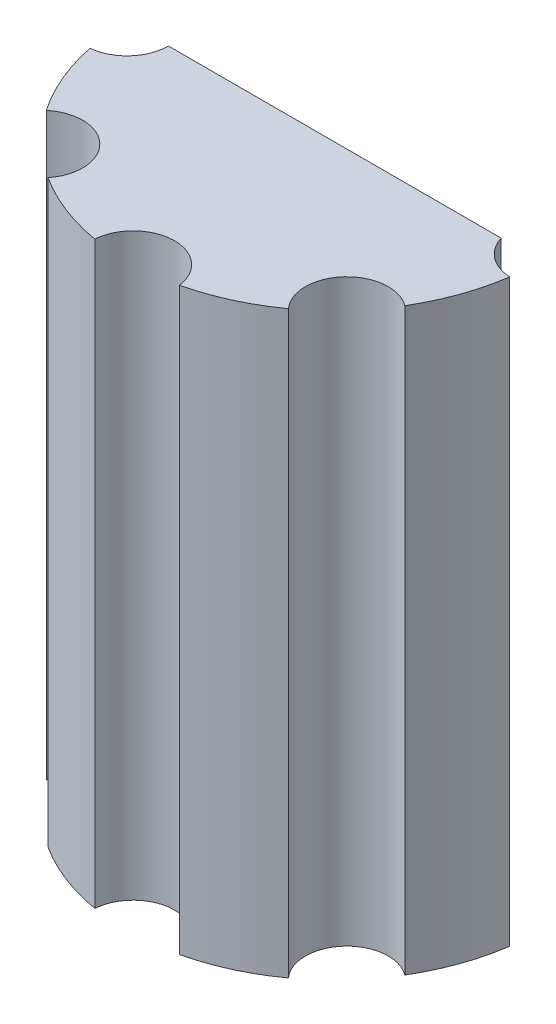
from build123d import *

# Parameters (mm, degrees)
BOSS_EXTRUDE2_DEPTH = 7
SKETCH3_R           = 0.5
CUT_EXTRUDE3_DEPTH  = 8.842193571


with BuildPart() as part:
    # Sketch1 → Boss-Extrude2 (new body)
    with BuildSketch(Plane(origin=(0, 0, 0), x_dir=(1, 0, 0), z_dir=(0, 1, 0))):
        with BuildLine():
            Line((-2.5, 0), (2.5, 0))
            ThreePointArc((2.5, 0), (0, -2.5), (-2.5, 0))
        make_face()
    extrude(amount=BOSS_EXTRUDE2_DEPTH)

    # Sketch3 → Cut-Extrude3 (cut, through all)
    with BuildSketch(Plane(origin=(0, 0, 0), x_dir=(1, 0, 0), z_dir=(0, 1, 0))):
        with Locations((-2.5, 0)):
            Circle(SKETCH3_R)
        with Locations((-1.741766773, -1.793390227)):
            Circle(SKETCH3_R)
        with Locations((0.072998806, -2.498934008)):
            Circle(SKETCH3_R)
        with Locations((1.843484289, -1.688657951)):
            Circle(SKETCH3_R)
        with Locations((2.495736939, 0.145935359)):
            Circle(SKETCH3_R)
    extrude(amount=CUT_EXTRUDE3_DEPTH, mode=Mode.SUBTRACT)


solid = part.part
